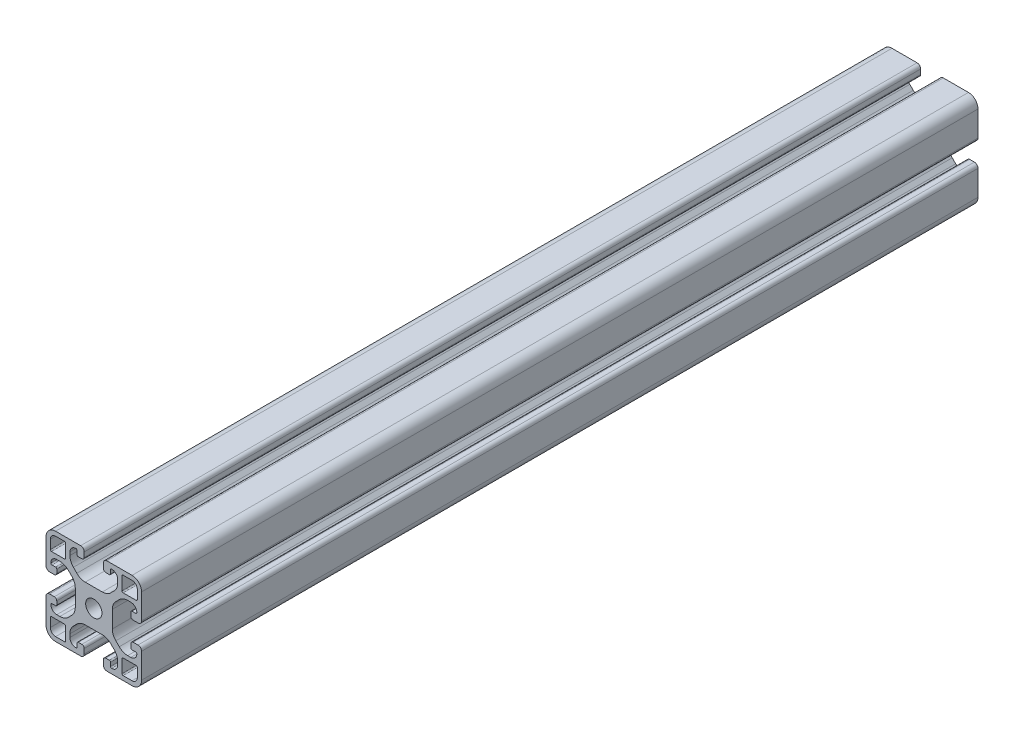
from build123d import *

# Parameters (mm, degrees)
SKETCH1_R           = 3.4
BOSS_EXTRUDE1_DEPTH = 350


with BuildPart() as part:
    # Sketch1 → Boss-Extrude1 (new body)
    with BuildSketch(Plane.XY):
        with BuildLine():
            Line((0, 36), (0, 25.5))
            ThreePointArc((0, 25.5), (0.439339828, 24.439339828), (1.5, 24))
            Line((1.5, 24), (3.5, 24))
            ThreePointArc((3.5, 24), (4.207106781, 24.292893219), (4.5, 25))
            Line((4.5, 25), (4.5, 26.5))
            ThreePointArc((4.5, 26.5), (4.353553391, 26.853553391), (4, 27))
            Line((4, 27), (2.5, 27))
            ThreePointArc((2.5, 27), (2.146446609, 27.146446609), (2, 27.5))
            ThreePointArc((2, 27.5), (2.732233047, 29.267766953), (4.5, 30))
            Line((4.5, 30), (5.807611845, 30))
            ThreePointArc((5.807611845, 30), (7.721029006, 29.619397663), (9.343145751, 28.535533906))
            Line((9.343145751, 28.535533906), (10.785533906, 27.093145751))
            ThreePointArc((10.785533906, 27.093145751), (11.869397663, 25.471029006), (12.25, 23.557611845))
            Line((12.25, 23.557611845), (12.25, 16.442388155))
            ThreePointArc((12.25, 16.442388155), (11.869397663, 14.528970994), (10.785533906, 12.906854249))
            Line((10.785533906, 12.906854249), (9.343145751, 11.464466094))
            ThreePointArc((9.343145751, 11.464466094), (7.721029006, 10.380602337), (5.807611845, 10))
            Line((5.807611845, 10), (4.5, 10))
            ThreePointArc((4.5, 10), (2.732233047, 10.732233047), (2, 12.5))
            ThreePointArc((2, 12.5), (2.146446609, 12.853553391), (2.5, 13))
            Line((2.5, 13), (4, 13))
            ThreePointArc((4, 13), (4.353553391, 13.146446609), (4.5, 13.5))
            Line((4.5, 13.5), (4.5, 15))
            ThreePointArc((4.5, 15), (4.207106781, 15.707106781), (3.5, 16))
            Line((3.5, 16), (1.5, 16))
            ThreePointArc((1.5, 16), (0.439339828, 15.560660172), (0, 14.5))
            Line((0, 14.5), (0, 4))
            ThreePointArc((0, 4), (1.171572875, 1.171572875), (4, 0))
            Line((4, 0), (14.5, 0))
            ThreePointArc((14.5, 0), (15.560660172, 0.439339828), (16, 1.5))
            Line((16, 1.5), (16, 3.5))
            ThreePointArc((16, 3.5), (15.707106781, 4.207106781), (15, 4.5))
            Line((15, 4.5), (13.5, 4.5))
            ThreePointArc((13.5, 4.5), (13.146446609, 4.353553391), (13, 4))
            Line((13, 4), (13, 2.5))
            ThreePointArc((13, 2.5), (12.853553391, 2.146446609), (12.5, 2))
            ThreePointArc((12.5, 2), (10.732233047, 2.732233047), (10, 4.5))
            Line((10, 4.5), (10, 5.807611845))
            ThreePointArc((10, 5.807611845), (10.380602337, 7.721029006), (11.464466094, 9.343145751))
            Line((11.464466094, 9.343145751), (12.906854249, 10.785533906))
            ThreePointArc((12.906854249, 10.785533906), (14.528970994, 11.869397663), (16.442388155, 12.25))
            Line((16.442388155, 12.25), (23.557611845, 12.25))
            ThreePointArc((23.557611845, 12.25), (25.471029006, 11.869397663), (27.093145751, 10.785533906))
            Line((27.093145751, 10.785533906), (28.535533906, 9.343145751))
            ThreePointArc((28.535533906, 9.343145751), (29.619397663, 7.721029006), (30, 5.807611845))
            Line((30, 5.807611845), (30, 4.5))
            ThreePointArc((30, 4.5), (29.267766953, 2.732233047), (27.5, 2))
            ThreePointArc((27.5, 2), (27.146446609, 2.146446609), (27, 2.5))
            Line((27, 2.5), (27, 4))
            ThreePointArc((27, 4), (26.853553391, 4.353553391), (26.5, 4.5))
            Line((26.5, 4.5), (25, 4.5))
            ThreePointArc((25, 4.5), (24.292893219, 4.207106781), (24, 3.5))
            Line((24, 3.5), (24, 1.5))
            ThreePointArc((24, 1.5), (24.439339828, 0.439339828), (25.5, 0))
            Line((25.5, 0), (36, 0))
            ThreePointArc((36, 0), (38.828427125, 1.171572875), (40, 4))
            Line((40, 4), (40, 14.5))
            ThreePointArc((40, 14.5), (39.560660172, 15.560660172), (38.5, 16))
            Line((38.5, 16), (36.5, 16))
            ThreePointArc((36.5, 16), (35.792893219, 15.707106781), (35.5, 15))
            Line((35.5, 15), (35.5, 13.5))
            ThreePointArc((35.5, 13.5), (35.646446609, 13.146446609), (36, 13))
            Line((36, 13), (37.5, 13))
            ThreePointArc((37.5, 13), (37.853553391, 12.853553391), (38, 12.5))
            ThreePointArc((38, 12.5), (37.267766953, 10.732233047), (35.5, 10))
            Line((35.5, 10), (34.192388155, 10))
            ThreePointArc((34.192388155, 10), (32.278970994, 10.380602337), (30.656854249, 11.464466094))
            Line((30.656854249, 11.464466094), (29.214466094, 12.906854249))
            ThreePointArc((29.214466094, 12.906854249), (28.130602337, 14.528970994), (27.75, 16.442388155))
            Line((27.75, 16.442388155), (27.75, 23.557611845))
            ThreePointArc((27.75, 23.557611845), (28.130602337, 25.471029006), (29.214466094, 27.093145751))
            Line((29.214466094, 27.093145751), (30.656854249, 28.535533906))
            ThreePointArc((30.656854249, 28.535533906), (32.278970994, 29.619397663), (34.192388155, 30))
            Line((34.192388155, 30), (35.5, 30))
            ThreePointArc((35.5, 30), (37.267766953, 29.267766953), (38, 27.5))
            ThreePointArc((38, 27.5), (37.853553391, 27.146446609), (37.5, 27))
            Line((37.5, 27), (36, 27))
            ThreePointArc((36, 27), (35.646446609, 26.853553391), (35.5, 26.5))
            Line((35.5, 26.5), (35.5, 25))
            ThreePointArc((35.5, 25), (35.792893219, 24.292893219), (36.5, 24))
            Line((36.5, 24), (38.5, 24))
            ThreePointArc((38.5, 24), (39.560660172, 24.439339828), (40, 25.5))
            Line((40, 25.5), (40, 36))
            ThreePointArc((40, 36), (38.828427125, 38.828427125), (36, 40))
            Line((36, 40), (25.5, 40))
            ThreePointArc((25.5, 40), (24.439339828, 39.560660172), (24, 38.5))
            Line((24, 38.5), (24, 36.5))
            ThreePointArc((24, 36.5), (24.292893219, 35.792893219), (25, 35.5))
            Line((25, 35.5), (26.5, 35.5))
            ThreePointArc((26.5, 35.5), (26.853553391, 35.646446609), (27, 36))
            Line((27, 36), (27, 37.5))
            ThreePointArc((27, 37.5), (27.146446609, 37.853553391), (27.5, 38))
            ThreePointArc((27.5, 38), (29.267766953, 37.267766953), (30, 35.5))
            Line((30, 35.5), (30, 34.192388155))
            ThreePointArc((30, 34.192388155), (29.619397663, 32.278970994), (28.535533906, 30.656854249))
            Line((28.535533906, 30.656854249), (27.093145751, 29.214466094))
            ThreePointArc((27.093145751, 29.214466094), (25.471029006, 28.130602337), (23.557611845, 27.75))
            Line((23.557611845, 27.75), (16.442388155, 27.75))
            ThreePointArc((16.442388155, 27.75), (14.528970994, 28.130602337), (12.906854249, 29.214466094))
            Line((12.906854249, 29.214466094), (11.464466094, 30.656854249))
            ThreePointArc((11.464466094, 30.656854249), (10.380602337, 32.278970994), (10, 34.192388155))
            Line((10, 34.192388155), (10, 35.5))
            ThreePointArc((10, 35.5), (10.732233047, 37.267766953), (12.5, 38))
            ThreePointArc((12.5, 38), (12.853553391, 37.853553391), (13, 37.5))
            Line((13, 37.5), (13, 36))
            ThreePointArc((13, 36), (13.146446609, 35.646446609), (13.5, 35.5))
            Line((13.5, 35.5), (15, 35.5))
            ThreePointArc((15, 35.5), (15.707106781, 35.792893219), (16, 36.5))
            Line((16, 36.5), (16, 38.5))
            ThreePointArc((16, 38.5), (15.560660172, 39.560660172), (14.5, 40))
            Line((14.5, 40), (4, 40))
            ThreePointArc((4, 40), (1.171572875, 38.828427125), (0, 36))
        make_face()
        with Locations(Location((20, 20, 0), (0, 0, 180))):
            Circle(SKETCH1_R, mode=Mode.SUBTRACT)
        with BuildLine():
            Line((1.8, 4), (1.8, 7.7))
            ThreePointArc((1.8, 7.7), (1.946446609, 8.053553391), (2.3, 8.2))
            Line((2.3, 8.2), (7.7, 8.2))
            ThreePointArc((7.7, 8.2), (8.053553391, 8.053553391), (8.2, 7.7))
            Line((8.2, 7.7), (8.2, 2.3))
            ThreePointArc((8.2, 2.3), (8.053553391, 1.946446609), (7.7, 1.8))
            Line((7.7, 1.8), (4, 1.8))
            ThreePointArc((4, 1.8), (2.444365081, 2.444365081), (1.8, 4))
        make_face(mode=Mode.SUBTRACT)
        with BuildLine():
            Line((4, 38.2), (7.7, 38.2))
            ThreePointArc((7.7, 38.2), (8.053553391, 38.053553391), (8.2, 37.7))
            Line((8.2, 37.7), (8.2, 32.3))
            ThreePointArc((8.2, 32.3), (8.053553391, 31.946446609), (7.7, 31.8))
            Line((7.7, 31.8), (2.3, 31.8))
            ThreePointArc((2.3, 31.8), (1.946446609, 31.946446609), (1.8, 32.3))
            Line((1.8, 32.3), (1.8, 36))
            ThreePointArc((1.8, 36), (2.444365081, 37.555634919), (4, 38.2))
        make_face(mode=Mode.SUBTRACT)
        with BuildLine():
            Line((31.8, 32.3), (31.8, 37.7))
            ThreePointArc((31.8, 37.7), (31.946446609, 38.053553391), (32.3, 38.2))
            Line((32.3, 38.2), (36, 38.2))
            ThreePointArc((36, 38.2), (37.555634919, 37.555634919), (38.2, 36))
            Line((38.2, 36), (38.2, 32.3))
            ThreePointArc((38.2, 32.3), (38.053553391, 31.946446609), (37.7, 31.8))
            Line((37.7, 31.8), (32.3, 31.8))
            ThreePointArc((32.3, 31.8), (31.946446609, 31.946446609), (31.8, 32.3))
        make_face(mode=Mode.SUBTRACT)
        with BuildLine():
            Line((32.3, 8.2), (37.7, 8.2))
            ThreePointArc((37.7, 8.2), (38.053553391, 8.053553391), (38.2, 7.7))
            Line((38.2, 7.7), (38.2, 4))
            ThreePointArc((38.2, 4), (37.555634919, 2.444365081), (36, 1.8))
            Line((36, 1.8), (32.3, 1.8))
            ThreePointArc((32.3, 1.8), (31.946446609, 1.946446609), (31.8, 2.3))
            Line((31.8, 2.3), (31.8, 7.7))
            ThreePointArc((31.8, 7.7), (31.946446609, 8.053553391), (32.3, 8.2))
        make_face(mode=Mode.SUBTRACT)
    extrude(amount=-BOSS_EXTRUDE1_DEPTH)


solid = part.part
